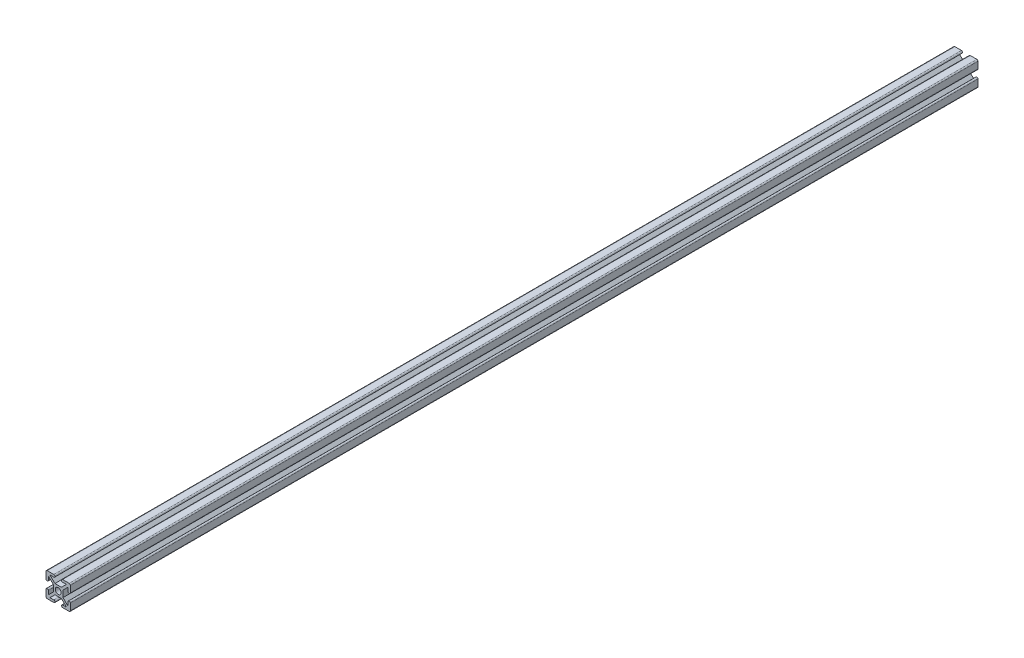
from build123d import *

# Parameters (mm, degrees)
CROQUIS1_R              = 3.645
SALIENTE_EXTRUIR1_DEPTH = 1119.12


with BuildPart() as part:
    # Croquis1 → Saliente-Extruir1 (new body)
    with BuildSketch(Plane.XY):
        with BuildLine():
            Line((-23.20408883, -1.991782405), (-18.47908883, -1.991782405))
            Line((-18.47908883, -1.991782405), (-24.62908883, 4.158217595))
            Line((-24.62908883, 4.158217595), (-32.62908883, 4.158217595))
            Line((-32.62908883, 4.158217595), (-38.77908883, -1.991782405))
            Line((-38.77908883, -1.991782405), (-34.05408883, -1.991782405))
            ThreePointArc((-34.05408883, -1.991782405), (-32.62908883, -3.416782405), (-34.05408883, -4.841782405))
            Line((-34.05408883, -4.841782405), (-42.230524603, -4.815346633))
            ThreePointArc((-42.230524603, -4.815346633), (-43.219458852, -4.405716654), (-43.62908883, -3.416782405))
            Line((-43.62908883, -3.416782405), (-43.62908883, 4.733217595))
            ThreePointArc((-43.62908883, 4.733217595), (-42.230524603, 6.131781822), (-40.831960375, 4.733217595))
            Line((-40.831960375, 4.733217595), (-40.831960375, 0.008217595))
            Line((-40.831960375, 0.008217595), (-34.681960375, 6.158217595))
            Line((-34.681960375, 6.158217595), (-34.681960375, 14.158217595))
            Line((-34.681960375, 14.158217595), (-40.831960375, 20.308217595))
            Line((-40.831960375, 20.308217595), (-40.831960375, 15.583217595))
            ThreePointArc((-40.831960375, 15.583217595), (-42.256960375, 14.158217595), (-43.681960375, 15.583217595))
            Line((-43.681960375, 15.583217595), (-43.681960375, 23.733171005))
            ThreePointArc((-43.681960375, 23.733171005), (-43.264587539, 24.740798168), (-42.256960375, 25.158171005))
            Line((-42.256960375, 25.158171005), (-34.106960375, 25.158171005))
            ThreePointArc((-34.106960375, 25.158171005), (-32.681960375, 23.733171005), (-34.106960375, 22.308171005))
            Line((-34.106960375, 22.308171005), (-38.831960375, 22.308171005))
            Line((-38.831960375, 22.308171005), (-32.681960375, 16.158171005))
            Line((-32.681960375, 16.158171005), (-24.681960375, 16.158171005))
            Line((-24.681960375, 16.158171005), (-18.531960375, 22.308171005))
            Line((-18.531960375, 22.308171005), (-23.256960375, 22.308171005))
            ThreePointArc((-23.256960375, 22.308171005), (-24.681960375, 23.733171005), (-23.256960375, 25.158171005))
            Line((-23.256960375, 25.158171005), (-15.106960375, 25.158171005))
            ThreePointArc((-15.106960375, 25.158171005), (-14.099333212, 24.740798168), (-13.681960375, 23.733171005))
            Line((-13.681960375, 23.733171005), (-13.681960375, 15.68691469))
            ThreePointArc((-13.681960375, 15.68691469), (-15.106960375, 14.26191469), (-16.531960375, 15.68691469))
            Line((-16.531960375, 15.68691469), (-16.531960375, 20.308171005))
            Line((-16.531960375, 20.308171005), (-22.681960375, 14.158171005))
            Line((-22.681960375, 14.158171005), (-22.681960375, 6.158171005))
            Line((-22.681960375, 6.158171005), (-16.531960375, 0.008171005))
            Line((-16.531960375, 0.008171005), (-16.531960375, 4.83691469))
            ThreePointArc((-16.531960375, 4.83691469), (-15.106960375, 6.26191469), (-13.681960375, 4.83691469))
            Line((-13.681960375, 4.83691469), (-13.681960375, -3.416782405))
            ThreePointArc((-13.681960375, -3.416782405), (-14.099333212, -4.424409569), (-15.106960375, -4.841782405))
            Line((-15.106960375, -4.841782405), (-23.20408883, -4.841782405))
            ThreePointArc((-23.20408883, -4.841782405), (-24.62908883, -3.416782405), (-23.20408883, -1.991782405))
        make_face()
        with Locations((-28.62908883, 10.158217595)):
            Circle(CROQUIS1_R, mode=Mode.SUBTRACT)
    extrude(amount=SALIENTE_EXTRUIR1_DEPTH)


solid = part.part
